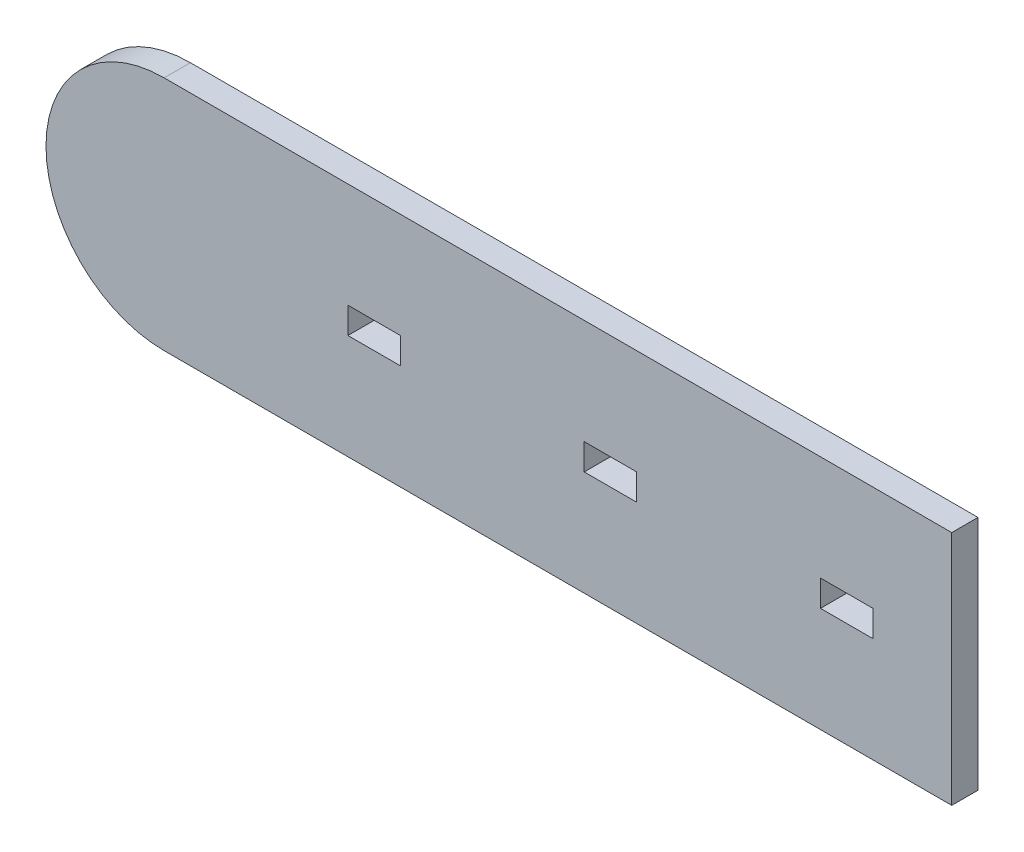
from build123d import *

# Parameters (mm, degrees)
ESQUISSE1_W        = 10
ESQUISSE1_H        = 5
BOSS_EXTRU_1_DEPTH = 5


with BuildPart() as part:
    # Esquisse1 → Boss.-Extru.1 (new body)
    with BuildSketch(Plane.XY):
        with BuildLine():
            Line((150, 22.5), (0, 22.5))
            ThreePointArc((0, 22.5), (-22.5, 0), (0, -22.5))
            Line((0, -22.5), (150, -22.5))
            Line((150, -22.5), (150, 22.5))
        make_face()
        with Locations((40, 0)):
            Rectangle(ESQUISSE1_W, ESQUISSE1_H, mode=Mode.SUBTRACT)
        with Locations((85, 0)):
            Rectangle(ESQUISSE1_W, ESQUISSE1_H, mode=Mode.SUBTRACT)
        with Locations((130, 0)):
            Rectangle(ESQUISSE1_W, ESQUISSE1_H, mode=Mode.SUBTRACT)
    extrude(amount=BOSS_EXTRU_1_DEPTH)


solid = part.part
